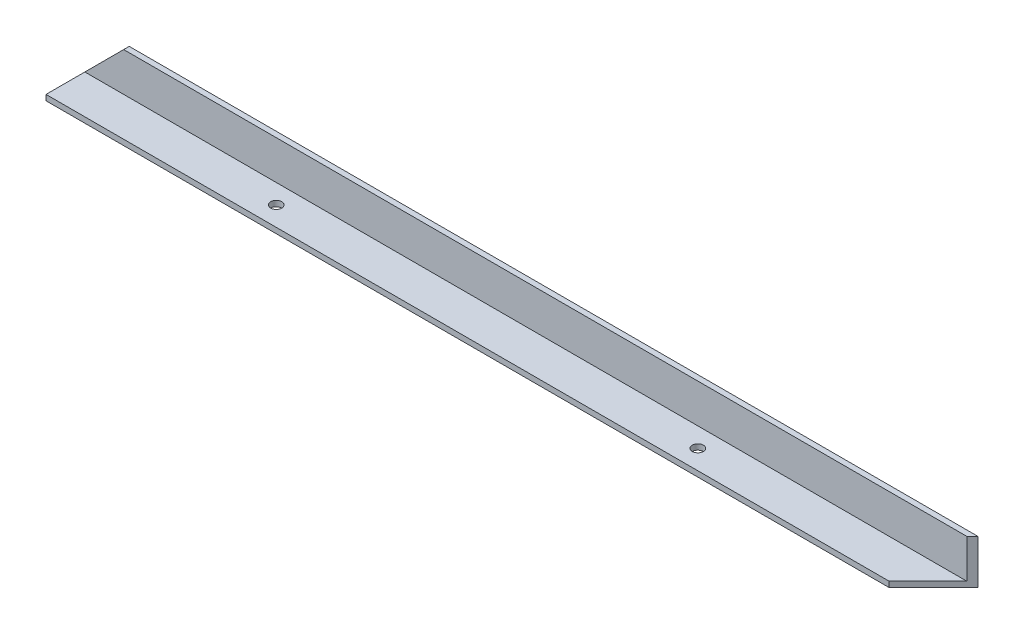
from build123d import *

# Parameters (mm, degrees)
SKETCH1_W           = 508
SKETCH1_H           = 25.4
BOSS_EXTRUDE1_DEPTH = 3.175
SKETCH2_W           = 508
SKETCH2_H           = 3.175
BOSS_EXTRUDE2_DEPTH = 22.225
CUT_EXTRUDE2_DEPTH  = 3.175
CUT_EXTRUDE4_REACH  = 511.268
SKETCH6_R           = 3.175
CUT_EXTRUDE5_DEPTH  = 3.175


with BuildPart() as part:
    # Sketch1 → Boss-Extrude1 (new body)
    with BuildSketch(Plane(origin=(0, 0, 0), x_dir=(1, 0, 0), z_dir=(0, 1, 0))):
        with Locations((-254, -12.7)):
            Rectangle(SKETCH1_W, SKETCH1_H)
    extrude(amount=BOSS_EXTRUDE1_DEPTH)

    # Sketch2 → Boss-Extrude2 (add)
    with BuildSketch(Plane(origin=(0, 3.175, 0), x_dir=(1, 0, 0), z_dir=(0, 1, 0))):
        with Locations((-254, -1.5875)):
            Rectangle(SKETCH2_W, SKETCH2_H)
    extrude(amount=BOSS_EXTRUDE2_DEPTH)

    # Sketch5 → Cut-Extrude2 (cut)
    with BuildSketch(Plane.XY.offset(3.175)):
        Polygon((-508, 3.175), (-465.673401845, 45.501598155), (-525.455809911, 41.886038328), align=None)
    extrude(amount=-CUT_EXTRUDE2_DEPTH, mode=Mode.SUBTRACT)

    # Cut-Extrude4: up to this face of the body (flat: up to its plane)
    cut_extrude4_end = Plane(part.part.faces().sort_by_distance((-254, 0, 12.7))[0])
    # Sketch3 → Cut-Extrude4 (cut, up to the picked face)
    with BuildSketch(Plane(origin=(0, 25.4, 0), x_dir=(1, 0, 0), z_dir=(0, 1, 0)), mode=Mode.PRIVATE) as cut_extrude4_sk1:
        Polygon((0, 0), (-52.33160776, -52.33160776), (49.536132654, -29.784007044), align=None)
    cut_extrude4_tool1 = split(extrude(cut_extrude4_sk1.sketch, amount=-CUT_EXTRUDE4_REACH, mode=Mode.PRIVATE), bisect_by=cut_extrude4_end, keep=Keep.BOTH, mode=Mode.PRIVATE)
    add(cut_extrude4_tool1.solids().sort_by(Axis((-0.931825, 25.4, 27.371872), (0, -1, 0)))[0], mode=Mode.SUBTRACT)

    # Sketch6 → Cut-Extrude5 (cut)
    with BuildSketch(Plane(origin=(0, 3.175, 0), x_dir=(1, 0, 0), z_dir=(0, 1, 0))):
        with Locations(Location((-146.05, -14.2875, 0), (0, 0, 270))):
            Circle(SKETCH6_R)
        with Locations(Location((-387.35, -14.2875, 0), (0, 0, 90))):
            Circle(SKETCH6_R)
    extrude(amount=-CUT_EXTRUDE5_DEPTH, mode=Mode.SUBTRACT)


solid = part.part
